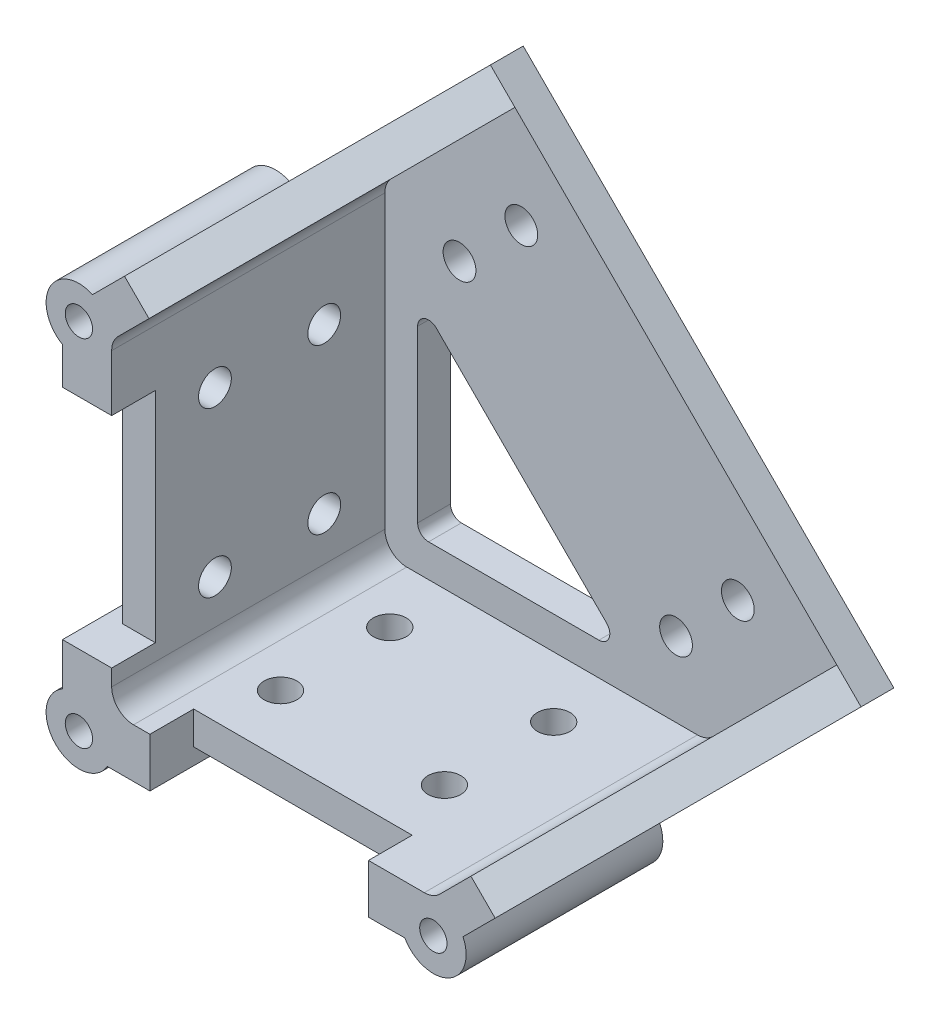
from build123d import *
from build123d.topology import SkipClean

# Parameters (mm, degrees)
SKETCH_1_R                = 1.5
SKETCH_1_R_2              = 1.25
SKETCH_1_W                = 25
SKETCH_1_H                = 25
EXTRUDE_1_DEPTH           = 26
FILLET_1_R                = 3
FILLET_3_R                = 1
SKETCH_3_W                = 1.5
SKETCH_3_H                = 1.5
CUT_EXTRUDE_2_DEPTH       = 37.884956283
SKETCH_4_W                = 1.5
SKETCH_4_H                = 1.5
EXTRUDE_2_DEPTH           = 26
CUT_EXTRUDE_3_DEPTH       = 37.884956283
FILLET_4_R                = 3
SKETCH_9_R                = 1.5
CUT_EXTRUDE_6_DEPTH       = 10
SKETCH_10_R               = 3
CUT_EXTRUDE_7_DEPTH       = 10
CUT_EXTRUDE_9_DEPTH       = 37.884956283
SKETCH_13_W               = 4.17784283
SKETCH_13_H               = 6.481383992
SKETCH_13_W_2             = 7.357798492
SKETCH_13_H_2             = 3.821610345
CUT_EXTRUDE_10_DEPTH      = 37.884956283
FILLET_6_R                = 2
EXTRUDE_START             = -22
EXTRUDE_5_DEPTH           = 4
EXTRUDE_START_2           = 2
EXTRUDE_6_DEPTH           = 2
CUT_EXTRUDE_12_DEPTH      = 3
SKETCH_21_R               = 1.5
CUT_EXTRUDE_13_DEPTH      = 37.884956283
EXTRUDE_7_DEPTH           = 28
CUT_EXTRUDE_14_DEPTH      = 25
SKETCH_24_R               = 3
EXTRUDE_8_DEPTH           = 28
SKETCH_25_R               = 1.25
CUT_EXTRUDE_16_DEPTH      = 53.140414679
CUT_EXTRUDE_17_DEPTH      = 50
SKETCH_27_W               = 20
SKETCH_27_H               = 4
CUT_EXTRUDE_18_DEPTH      = 5
SKETCH_28_R               = 1.5
CUT_EXTRUDE_19_DEPTH      = 51.592715315
SKETCH_29_R               = 1.5
EXTRUDE_9_DEPTH           = 11
CUT_EXTRUDE_START         = -10
CUT_EXTRUDE_21_DEPTH      = 10
EXTRUDE_START_3           = -11
SKETCH_31_R               = 1.5
EXTRUDE_10_DEPTH          = 11
CUT_EXTRUDE_22_DEPTH      = 10
FILLET_9_R                = 2
CUT_EXTRUDE_25_DEPTH      = 51.592715315
CUT_EXTRUDE_25_DEPTH_BACK = 10
FILLET_10_R               = 1


with BuildPart() as part:
    # 草图1 → 凸台-拉伸1 (new body)
    with BuildSketch(Plane.XY):
        with BuildLine():
            Line((-7.5, -17), (-7.5, -15.5))
            Line((-7.5, -15.5), (12.5, -15.5))
            Line((12.5, -15.5), (12.5, -18.5))
            ThreePointArc((12.5, -18.5), (14.621320344, -17.621320344), (15.5, -15.5))
            Line((15.5, -15.5), (15.5, -3))
            ThreePointArc((15.5, -3), (18.5, 0), (15.5, 3))
            Line((15.5, 3), (15.5, 12.5))
            Line((15.5, 12.5), (15.5, 15.5))
            Line((15.5, 15.5), (12.5, 15.5))
            Line((12.5, 15.5), (3, 15.5))
            ThreePointArc((3, 15.5), (0, 18.5), (-3, 15.5))
            Line((-3, 15.5), (-15.5, 15.5))
            ThreePointArc((-15.5, 15.5), (-17.621320344, 14.621320344), (-18.5, 12.5))
            Line((-18.5, 12.5), (-15.5, 12.5))
            Line((-15.5, 12.5), (-15.5, -7.5))
            Line((-15.5, -7.5), (-17, -7.5))
            Line((-17, -7.5), (-17, -12.901923789))
            ThreePointArc((-17, -12.901923789), (-17.621320344, -17.621320344), (-12.901923789, -17))
            Line((-12.901923789, -17), (-7.5, -17))
        make_face()
        with Locations(Location((0, 15.5, 0), (0, 0, 180))):
            Circle(SKETCH_1_R, mode=Mode.SUBTRACT)
        with Locations(Location((15.5, 0, 0), (0, 0, 180))):
            Circle(SKETCH_1_R, mode=Mode.SUBTRACT)
        with Locations(Location((-15.5, -15.5, 0), (0, 0, 180))):
            Circle(SKETCH_1_R_2, mode=Mode.SUBTRACT)
        Rectangle(SKETCH_1_W, SKETCH_1_H, mode=Mode.SUBTRACT)
    extrude(amount=EXTRUDE_1_DEPTH)

    # 圆角1
    fillet_1_edges = [part.edges().sort_by_distance(p)[0] for p in [
        (15.5, 15.5, 13),
    ]]
    fillet(fillet_1_edges, radius=FILLET_1_R)

    # 圆角3
    fillet_3_edges = [part.edges().sort_by_distance(p)[0] for p in [
        (-7.5, -17, 13),
        (-17, -7.5, 13),
    ]]
    fillet(fillet_3_edges, radius=FILLET_3_R)

    # 草图3 → 切除-拉伸2 (cut, through all)
    with BuildSketch(Plane.XY.offset(26)):
        with Locations((-16.25, -8.25)):
            Rectangle(SKETCH_3_W, SKETCH_3_H)
        with Locations((-8.25, -16.25)):
            Rectangle(SKETCH_3_W, SKETCH_3_H)
    extrude(amount=-CUT_EXTRUDE_2_DEPTH, mode=Mode.SUBTRACT)

    # 草图4 → 凸台-拉伸2 (add)
    with BuildSketch(Plane.XY.offset(26)):
        with Locations((11.75, -16.25)):
            Rectangle(SKETCH_4_W, SKETCH_4_H)
        with Locations((-16.25, 11.75)):
            Rectangle(SKETCH_4_W, SKETCH_4_H)
    extrude(amount=-EXTRUDE_2_DEPTH)

    # 草图5 → 切除-拉伸3 (cut, through all)
    with BuildSketch(Plane.XY.offset(26)):
        with BuildLine():
            Line((-15.5, 15.5), (-18.126967889, 17.505423237))
            Line((-18.126967889, 17.505423237), (-21.288898959, 12.813385992))
            Line((-21.288898959, 12.813385992), (-20.091395342, 10.786398282))
            Line((-20.091395342, 10.786398282), (-17, 12.5))
            ThreePointArc((-17, 12.5), (-16.57963241, 14.164816205), (-15.5, 15.5))
        make_face()
        with BuildLine():
            Line((15.5, -15.5), (16.572032303, -16.222435068))
            Line((16.572032303, -16.222435068), (15.5, -18.155539341))
            Line((15.5, -18.155539341), (15.357517018, -18.412466729))
            Line((15.357517018, -18.412466729), (13.84319433, -19.423604832))
            Line((13.84319433, -19.423604832), (11.91983412, -18.918035781))
            Line((11.91983412, -18.918035781), (12.5, -17))
            ThreePointArc((12.5, -17), (14.164816205, -16.57963241), (15.5, -15.5))
        make_face()
    extrude(amount=-CUT_EXTRUDE_3_DEPTH, mode=Mode.SUBTRACT)

    # 圆角4
    fillet_4_edges = [part.edges().sort_by_distance(p)[0] for p in [
        (15.5, -15.5, 13),
        (-15.5, 15.5, 13),
    ]]
    fillet(fillet_4_edges, radius=FILLET_4_R)

    # 草图9 → 切除-拉伸6 (cut)
    with BuildSketch(Plane.XZ.offset(17)):
        with Locations(Location((8.5, 16.55, 0), (0, 0, 270))):
            Circle(SKETCH_9_R)
        with Locations(Location((8.5, 6.55, 0), (0, 0, 270))):
            Circle(SKETCH_9_R)
        with Locations(Location((-6.5, 6.55, 0), (0, 0, 270))):
            Circle(SKETCH_9_R)
        with Locations(Location((-6.5, 16.55, 0), (0, 0, 270))):
            Circle(SKETCH_9_R)
    cut_extrude_6 = extrude(amount=-CUT_EXTRUDE_6_DEPTH, mode=Mode.SUBTRACT)

    # 镜向3: 切除-拉伸6 across plane
    add(cut_extrude_6.mirror(Plane(origin=(0, 0, 0), x_dir=(0, 0, 1), z_dir=(0.7071067811865474, -0.7071067811865477, 0))), mode=Mode.SUBTRACT)

    # 草图10 → 切除-拉伸7 (cut)
    with BuildSketch(Plane.XZ.offset(-12.5)):
        with Locations(Location((-6.5, 16.55, 0), (0, 0, 270))):
            Circle(SKETCH_10_R)
        with Locations(Location((8.5, 16.55, 0), (0, 0, 270))):
            Circle(SKETCH_10_R)
        with Locations(Location((-6.5, 6.55, 0), (0, 0, 270))):
            Circle(SKETCH_10_R)
        with Locations(Location((8.5, 6.55, 0), (0, 0, 270))):
            Circle(SKETCH_10_R)
    cut_extrude_7 = extrude(amount=-CUT_EXTRUDE_7_DEPTH, mode=Mode.SUBTRACT)

    # 镜向4: 切除-拉伸7 across plane
    add(cut_extrude_7.mirror(Plane(origin=(0, 0, 0), x_dir=(0, 0, 1), z_dir=(0.7071067811865474, -0.7071067811865477, 0))), mode=Mode.SUBTRACT)

    # 草图11 → 切除-拉伸9 (cut, through all)
    with BuildSketch(Plane(origin=(0, 0, 0), x_dir=(-1, 0, 0), z_dir=(0, 0, -1))):
        Polygon((13.994201093, 15.5), (-15.5, -13.994201093), (-22.603324572, 9.550961025), (-15.881167108, 22.081431115), (-1.791633811, 22.883450419), align=None)
    extrude(amount=-CUT_EXTRUDE_9_DEPTH, mode=Mode.SUBTRACT)

    # 草图13 → 切除-拉伸10 (cut, through all)
    with BuildSketch(Plane(origin=(0, 0, 0), x_dir=(-1, 0, 0), z_dir=(0, 0, -1))):
        with Locations((-14.588921415, -14.234893089)):
            Rectangle(SKETCH_13_W, SKETCH_13_H)
        with Locations((14.673100339, 14.410805172)):
            Rectangle(SKETCH_13_W_2, SKETCH_13_H_2)
    extrude(amount=-CUT_EXTRUDE_10_DEPTH, mode=Mode.SUBTRACT)

    # 圆角6
    fillet_6_edges = [part.edges().sort_by_distance(p)[0] for p in [
        (-12.5, -12.5, 13),
    ]]
    fillet(fillet_6_edges, radius=FILLET_6_R)

    # 草图18 → 凸台-拉伸5 (add)
    with BuildSketch(Plane.XY.offset(26).offset(EXTRUDE_START)):
        Polygon((-12.5, 12.5), (12.5, -12.5), (-12.5, -12.5), align=None)
        with BuildLine():
            Line((-9.5, -8.5), (-9.5, 2.843145751))
            ThreePointArc((-9.5, 2.843145751), (-8.882683432, 3.767025283), (-7.792893219, 3.550252532))
            Line((-7.792893219, 3.550252532), (3.550252532, -7.792893219))
            ThreePointArc((3.550252532, -7.792893219), (3.767025283, -8.882683432), (2.843145751, -9.5))
            Line((2.843145751, -9.5), (-8.5, -9.5))
            ThreePointArc((-8.5, -9.5), (-9.207106781, -9.207106781), (-9.5, -8.5))
        make_face(mode=Mode.SUBTRACT)
    extrude(amount=-EXTRUDE_5_DEPTH)

    # 草图19 → 凸台-拉伸6 (add)
    with SkipClean():  # the faces are left unmerged after this step: merging them gives an invalid solid
        with BuildSketch(Plane(origin=(0, 0, 0), x_dir=(-1, 0, 0), z_dir=(0, 0, -1)).offset(EXTRUDE_START_2)):
            with BuildLine():
                Line((17, 12.5), (12.5, 12.5))
                Line((12.5, 12.5), (-12.5, -12.5))
                Line((-12.5, -12.5), (-12.5, -17))
                Line((-12.5, -17), (-11, -17))
                Line((-11, -17), (-11, -15.5))
                Line((-11, -15.5), (9, -15.5))
                Line((9, -15.5), (9, -17))
                Line((9, -17), (12.901923789, -17))
                ThreePointArc((12.901923789, -17), (17.621320344, -17.621320344), (17, -12.901923789))
                Line((17, -12.901923789), (17, -9))
                Line((17, -9), (15.5, -9))
                Line((15.5, -9), (15.5, 11))
                Line((15.5, 11), (17, 11))
                Line((17, 11), (17, 12.5))
            make_face()
        extrude(amount=-EXTRUDE_6_DEPTH)

    # 草图20 → 切除-拉伸12 (cut)
    with SkipClean():  # the faces are left unmerged after this step: merging them gives an invalid solid
        with BuildSketch(Plane.XY.offset(4)):
            with BuildLine():
                Line((-10.5, -12.5), (12.5, -12.5))
                Line((12.5, -12.5), (-12.5, 12.5))
                Line((-12.5, 12.5), (-12.5, -10.5))
                ThreePointArc((-12.5, -10.5), (-11.914213562, -11.914213562), (-10.5, -12.5))
            make_face()
            with BuildLine():
                Line((-8.5, -9.5), (2.843145751, -9.5))
                ThreePointArc((2.843145751, -9.5), (3.767025283, -8.882683432), (3.550252532, -7.792893219))
                Line((3.550252532, -7.792893219), (-7.792893219, 3.550252532))
                ThreePointArc((-7.792893219, 3.550252532), (-8.882683432, 3.767025283), (-9.5, 2.843145751))
                Line((-9.5, 2.843145751), (-9.5, -8.5))
                ThreePointArc((-9.5, -8.5), (-9.207106781, -9.207106781), (-8.5, -9.5))
            make_face(mode=Mode.SUBTRACT)
        extrude(amount=-CUT_EXTRUDE_12_DEPTH, mode=Mode.SUBTRACT)

    # 草图21 → 切除-拉伸13 (cut, through all)
    with SkipClean():  # the faces are left unmerged after this step: merging them gives an invalid solid
        with BuildSketch(Plane.XY):
            with Locations((-15.5, -15.5)):
                Circle(SKETCH_21_R)
            with BuildLine():
                Line((-8.5, -9.5), (2.843145751, -9.5))
                ThreePointArc((2.843145751, -9.5), (3.767025283, -8.882683432), (3.550252532, -7.792893219))
                Line((3.550252532, -7.792893219), (-7.792893219, 3.550252532))
                ThreePointArc((-7.792893219, 3.550252532), (-8.882683432, 3.767025283), (-9.5, 2.843145751))
                Line((-9.5, 2.843145751), (-9.5, -8.5))
                ThreePointArc((-9.5, -8.5), (-9.207106781, -9.207106781), (-8.5, -9.5))
            make_face()
        extrude(amount=-CUT_EXTRUDE_13_DEPTH, mode=Mode.SUBTRACT)

    # 草图22 → 凸台-拉伸7 (add)
    with SkipClean():  # the faces are left unmerged after this step: merging them gives an invalid solid
        with BuildSketch(Plane(origin=(0, 0, -2), x_dir=(-1, 0, 0), z_dir=(0, 0, -1))):
            Polygon((12.5, 12.5), (17, 12.5), (16.982727844, 16.982727844), (2.84059222, 31.124863468), (-31.07838022, -2.794108972), (-16.936244596, -16.936244596), (-12.5, -17), (-12.5, -12.5), align=None)
        extrude(amount=-EXTRUDE_7_DEPTH)

    # 草图23 → 切除-拉伸14 (cut)
    with SkipClean():  # the faces are left unmerged after this step: merging them gives an invalid solid
        with BuildSketch(Plane.XY.offset(26)):
            Polygon((-12.5, 12.5), (-12.5, 16.982727844), (-0.599228298, 28.883499546), (28.860257922, -0.575986674), (16.936244596, -12.5), (12.5, -12.5), (11.087450154, -12.5), (-12.5, 11.087450154), align=None)
        extrude(amount=-CUT_EXTRUDE_14_DEPTH, mode=Mode.SUBTRACT)

    # 草图24 → 凸台-拉伸8 (add)
    with SkipClean():  # the faces are left unmerged after this step: merging them gives an invalid solid
        with BuildSketch(Plane.XY.offset(26)):
            with Locations((16.936244596, -15.5)):
                Circle(SKETCH_24_R)
            with Locations((-15.5, 16.982727844)):
                Circle(SKETCH_24_R)
        extrude(amount=-EXTRUDE_8_DEPTH)

    # 草图25 → 切除-拉伸16 (cut, through all)
    with SkipClean():  # the faces are left unmerged after this step: merging them gives an invalid solid
        with BuildSketch(Plane.XY.offset(26)):
            with Locations((16.936244596, -15.5)):
                Circle(SKETCH_25_R)
            with Locations((-15.5, 16.982727844)):
                Circle(SKETCH_25_R)
        extrude(amount=-CUT_EXTRUDE_16_DEPTH, mode=Mode.SUBTRACT)

    # 草图26 → 切除-拉伸17 (cut, symmetric)
    with SkipClean():  # the faces are left unmerged after this step: merging them gives an invalid solid
        with BuildSketch(Plane(origin=(14.718122298, -14.718122298, 0), x_dir=(0, 0, 1), z_dir=(-0.7071067811865477, 0.7071067811865474, 0))):
            Polygon((1, 20), (26, 20), (26, 8), align=None)
        extrude(amount=CUT_EXTRUDE_17_DEPTH, both=True, mode=Mode.SUBTRACT)

    # 草图27 → 切除-拉伸18 (cut)
    with SkipClean():  # the faces are left unmerged after this step: merging them gives an invalid solid
        with BuildSketch(Plane.XZ.offset(15.5)):
            with Locations((1, 24)):
                Rectangle(SKETCH_27_W, SKETCH_27_H)
        cut_extrude_18 = extrude(amount=-CUT_EXTRUDE_18_DEPTH, mode=Mode.SUBTRACT)

    # 镜向5: 切除-拉伸18 across plane
    with SkipClean():  # the faces are left unmerged after this step: merging them gives an invalid solid
        add(cut_extrude_18.mirror(Plane(origin=(0, 0, 0), x_dir=(0, 0, 1), z_dir=(0.7071067811865477, -0.7071067811865474, 0))), mode=Mode.SUBTRACT)

    # 草图28 → 切除-拉伸19 (cut, through all)
    with SkipClean():  # the faces are left unmerged after this step: merging them gives an invalid solid
        with BuildSketch(Plane.XY.offset(1)):
            with Locations((-0.012165095, 19.811154969)):
                Circle(SKETCH_28_R)
            with Locations((-5.669019345, 14.154300719)):
                Circle(SKETCH_28_R)
            with Locations(Location((19.79900051, 0.015516694, 0), (0, 0, 180))):
                Circle(SKETCH_28_R)
            with Locations(Location((14.14658339, -5.645771208, 0), (0, 0, 180))):
                Circle(SKETCH_28_R)
        extrude(amount=-CUT_EXTRUDE_19_DEPTH, mode=Mode.SUBTRACT)

    # 草图29 → 凸台-拉伸9 (add)
    with SkipClean():  # the faces are left unmerged after this step: merging them gives an invalid solid
        with BuildSketch(Plane(origin=(0, 0, -2), x_dir=(-1, 0, 0), z_dir=(0, 0, -1))):
            with Locations((15.5, 16.982727844)):
                Circle(SKETCH_29_R)
            with Locations((-16.936244596, -15.5)):
                Circle(SKETCH_29_R)
        extrude(amount=-EXTRUDE_9_DEPTH)

    # 草图30 → 切除-拉伸21 (cut)
    with SkipClean():  # the faces are left unmerged after this step: merging them gives an invalid solid
        with BuildSketch(Plane(origin=(0, 0, -2), x_dir=(-1, 0, 0), z_dir=(0, 0, -1)).offset(CUT_EXTRUDE_START)):
            with BuildLine():
                Line((14.25380775, 19.711647937), (16.992754417, 16.972701271))
                Line((16.992754417, 16.972701271), (16.992754417, 14.380481843))
                ThreePointArc((16.992754417, 14.380481843), (18.16843235, 18.353665039), (14.25380775, 19.711647937))
            make_face()
            with BuildLine():
                Line((-14.323215632, -16.973797691), (-16.8986915, -16.973797691))
                Line((-16.8986915, -16.973797691), (-19.650438126, -14.222051065))
                ThreePointArc((-19.650438126, -14.222051065), (-18.313047393, -18.165410674), (-14.323215632, -16.973797691))
            make_face()
        extrude(amount=CUT_EXTRUDE_21_DEPTH, mode=Mode.SUBTRACT)

    # 草图31 → 凸台-拉伸10 (add)
    with SkipClean():  # the faces are left unmerged after this step: merging them gives an invalid solid
        with BuildSketch(Plane(origin=(0, 0, -2), x_dir=(-1, 0, 0), z_dir=(0, 0, -1)).offset(EXTRUDE_START_3)):
            with Locations((15.5, -15.5)):
                Circle(SKETCH_31_R)
        extrude(amount=EXTRUDE_10_DEPTH)

    # 草图32 → 切除-拉伸22 (cut)
    with BuildSketch(Plane(origin=(0, 0, -2), x_dir=(-1, 0, 0), z_dir=(0, 0, -1))):
        with BuildLine():
            Line((17, -12.901923789), (17, -17))
            Line((17, -17), (12.901923789, -17))
            ThreePointArc((12.901923789, -17), (17.621320344, -17.621320344), (17, -12.901923789))
        make_face()
    extrude(amount=-CUT_EXTRUDE_22_DEPTH, mode=Mode.SUBTRACT)

    # 圆角9
    fillet_9_edges = [part.edges().sort_by_distance(p)[0] for p in [
        (-12.5, 16.982727844, 13.5),
        (16.936244596, -12.5, 13.5),
    ]]
    fillet(fillet_9_edges, radius=FILLET_9_R)

    # 草图35 → 切除-拉伸25 (cut, two sides: drawn at the far end of the back side and taken through both)
    with BuildSketch(Plane.XY.offset(1).offset(-CUT_EXTRUDE_25_DEPTH_BACK)):
        with BuildLine():
            Line((-9.5, 9.5), (-9.5, 2.843145751))
            ThreePointArc((-9.5, 2.843145751), (-8.882683432, 3.767025283), (-7.792893219, 3.550252532))
            Line((-7.792893219, 3.550252532), (3.550252532, -7.792893219))
            ThreePointArc((3.550252532, -7.792893219), (3.767025283, -8.882683432), (2.843145751, -9.5))
            Line((2.843145751, -9.5), (9.5, -9.5))
            Line((9.5, -9.5), (-9.5, 9.5))
        make_face()
    extrude(amount=CUT_EXTRUDE_25_DEPTH + CUT_EXTRUDE_25_DEPTH_BACK, mode=Mode.SUBTRACT)

    # 圆角10
    fillet_10_edges = [part.edges().sort_by_distance(p)[0] for p in [
        (9.5, -9.5, -0.5),
        (-9.5, 9.5, -0.5),
    ]]
    fillet(fillet_10_edges, radius=FILLET_10_R)


solid = part.part
